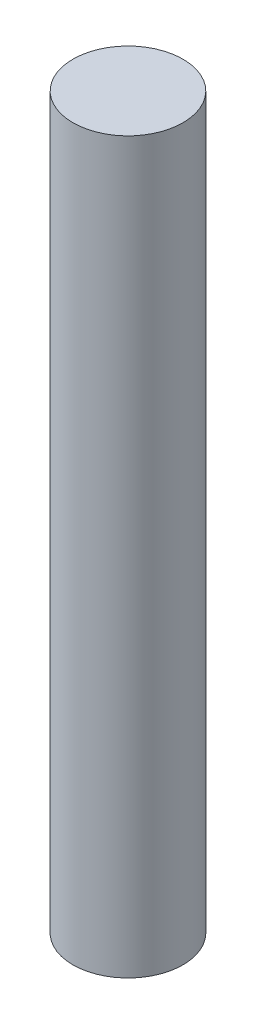
from build123d import *

# Parameters (mm, degrees)
SKETCH1_R           = 2
BOSS_EXTRUDE2_DEPTH = 26.5


with BuildPart() as part:
    # Sketch1 → Boss-Extrude2 (new body)
    with BuildSketch(Plane(origin=(0, 0, 0), x_dir=(1, 0, 0), z_dir=(0, 1, 0))):
        with Locations(Location((7.808063126, 19.815420706, 0), (0, 0, 270))):
            Circle(SKETCH1_R)
    extrude(amount=BOSS_EXTRUDE2_DEPTH)


solid = part.part
